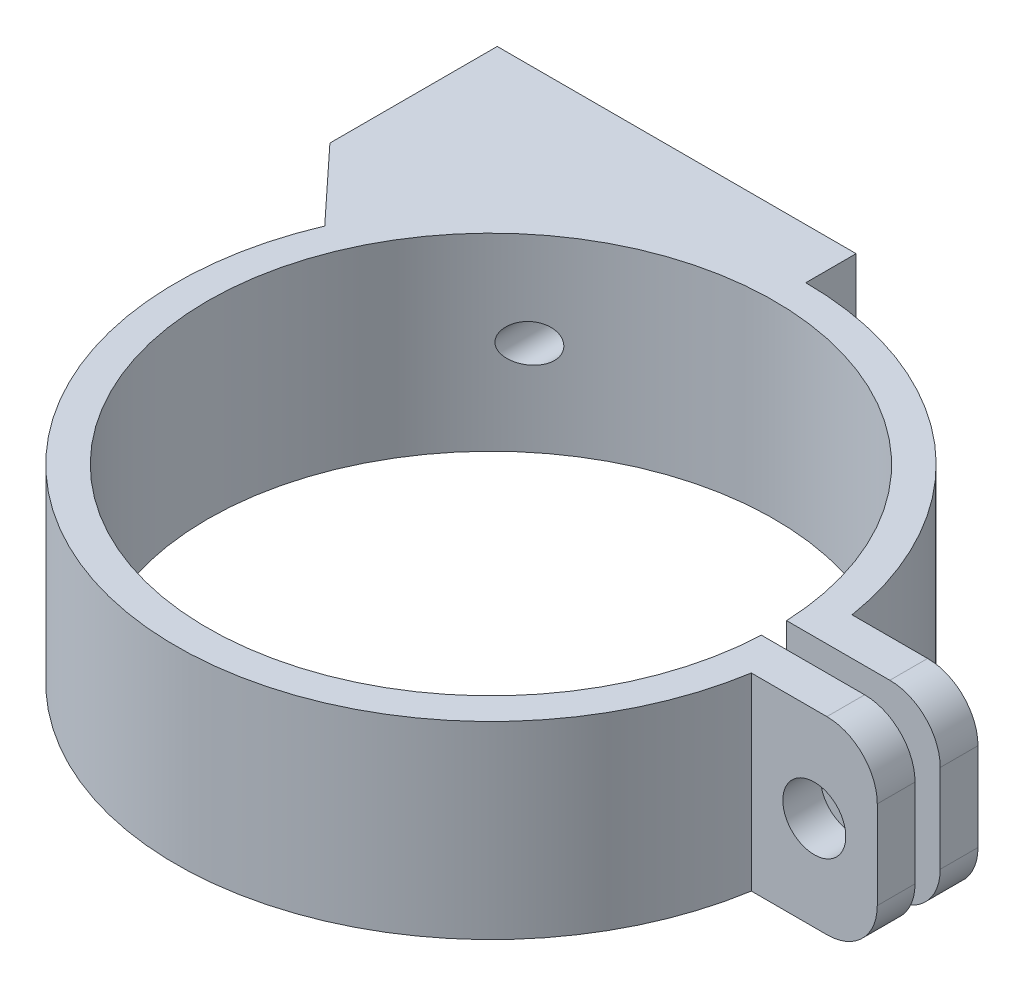
from build123d import *

# Parameters (mm, degrees)
SALIENTE_EXTRUIR1_DEPTH = 15
CROQUIS2_R              = 1.5
CORTAR_EXTRUIR1_DEPTH   = 17
CROQUIS3_R              = 2.5
CORTAR_EXTRUIR2_DEPTH   = 17
REDONDEO1_R             = 4


with BuildPart() as part:
    # Croquis1 → Saliente-Extruir1 (new body)
    with BuildSketch(Plane(origin=(0, 0, 0), x_dir=(1, 0, 0), z_dir=(0, 1, 0))):
        with BuildLine():
            Line((0, 25), (0, 29))
            Line((0, 29), (-28.5, 29))
            Line((-28.5, 29), (-28.5, 15.712290503))
            Line((-28.5, 15.712290503), (-22.998889471, 9.800565448))
            ThreePointArc((-22.998889471, 9.800565448), (-6.951164798, -24.014189721), (24.677925359, -4))
            Line((24.677925359, -4), (34.677925359, -4))
            Line((34.677925359, -4), (34.677925359, -1))
            Line((34.677925359, -1), (22.477766793, -1))
            ThreePointArc((22.477766793, -1), (-22.5, 0), (22.477766793, 1))
            Line((22.477766793, 1), (34.677925359, 1))
            Line((34.677925359, 1), (34.677925359, 4))
            Line((34.677925359, 4), (24.677925359, 4))
            ThreePointArc((24.677925359, 4), (16.201851746, 19.039432765), (0, 25))
        make_face()
    extrude(amount=SALIENTE_EXTRUIR1_DEPTH)

    # Croquis2 → Cortar-Extruir1 (cut)
    with BuildSketch(Plane(origin=(0, 0, -29), x_dir=(-1, 0, 0), z_dir=(0, 0, -1))):
        with Locations((14.25, 7.5)):
            Circle(CROQUIS2_R)
    extrude(amount=-CORTAR_EXTRUIR1_DEPTH, mode=Mode.SUBTRACT)

    # Croquis3 → Cortar-Extruir2 (cut)
    with BuildSketch(Plane(origin=(0, 0, -4), x_dir=(-1, 0, 0), z_dir=(0, 0, -1))):
        with Locations((-29.677925359, 7.5)):
            Circle(CROQUIS3_R)
    extrude(amount=-CORTAR_EXTRUIR2_DEPTH, mode=Mode.SUBTRACT)

    # Redondeo1
    redondeo1_edges = [part.edges().sort_by_distance(p)[0] for p in [
        (34.677925359, 0, -2.5),
        (34.677925359, 0, 2.5),
        (34.677925359, 15, 2.5),
        (34.677925359, 15, -2.5),
    ]]
    fillet(redondeo1_edges, radius=REDONDEO1_R)


solid = part.part
